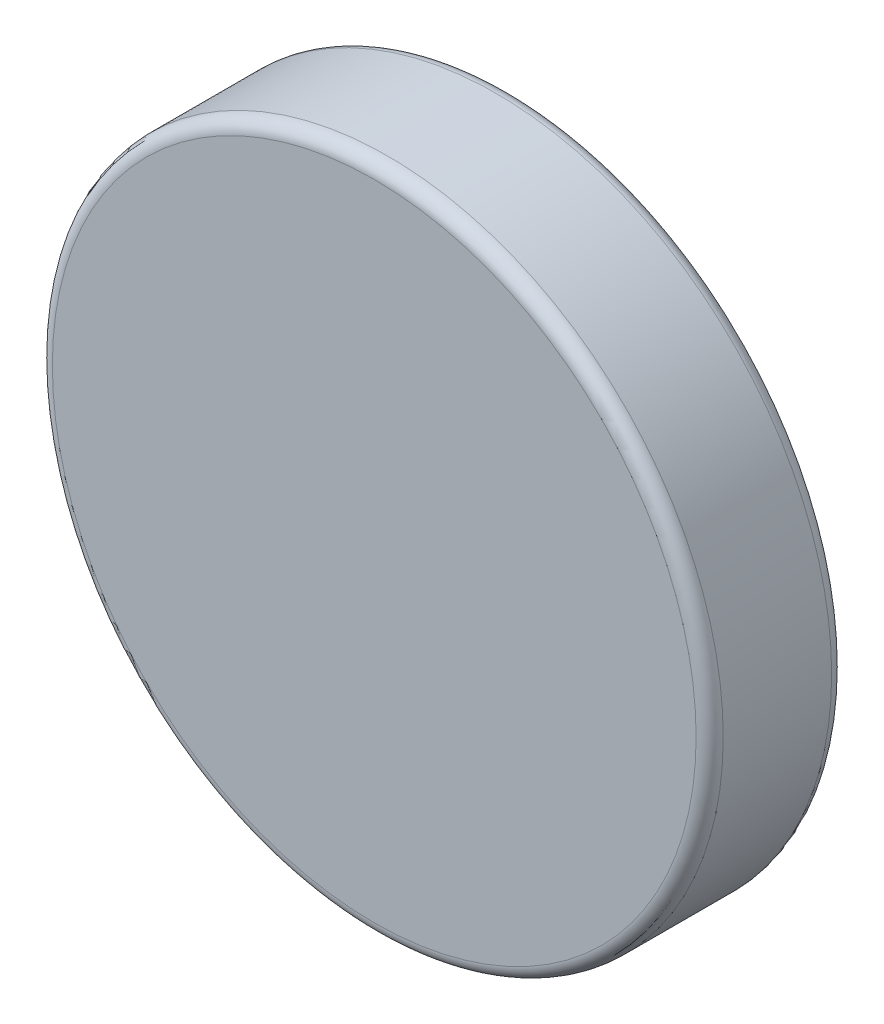
from build123d import *

# Parameters (mm, degrees)
ESQUISSE1_R        = 4.95
BOSS_EXTRU_1_DEPTH = 2
CONG_1_R           = 0.2


with BuildPart() as part:
    # Esquisse1 → Boss.-Extru.1 (new body)
    with BuildSketch(Plane.XY):
        Circle(ESQUISSE1_R)
    extrude(amount=BOSS_EXTRU_1_DEPTH)

    # Congé1
    cong_1_edges = [part.edges().sort_by_distance(p)[0] for p in [
        (-4.95, 0, 0),
        (-4.95, 0, 2),
    ]]
    fillet(cong_1_edges, radius=CONG_1_R)


solid = part.part
